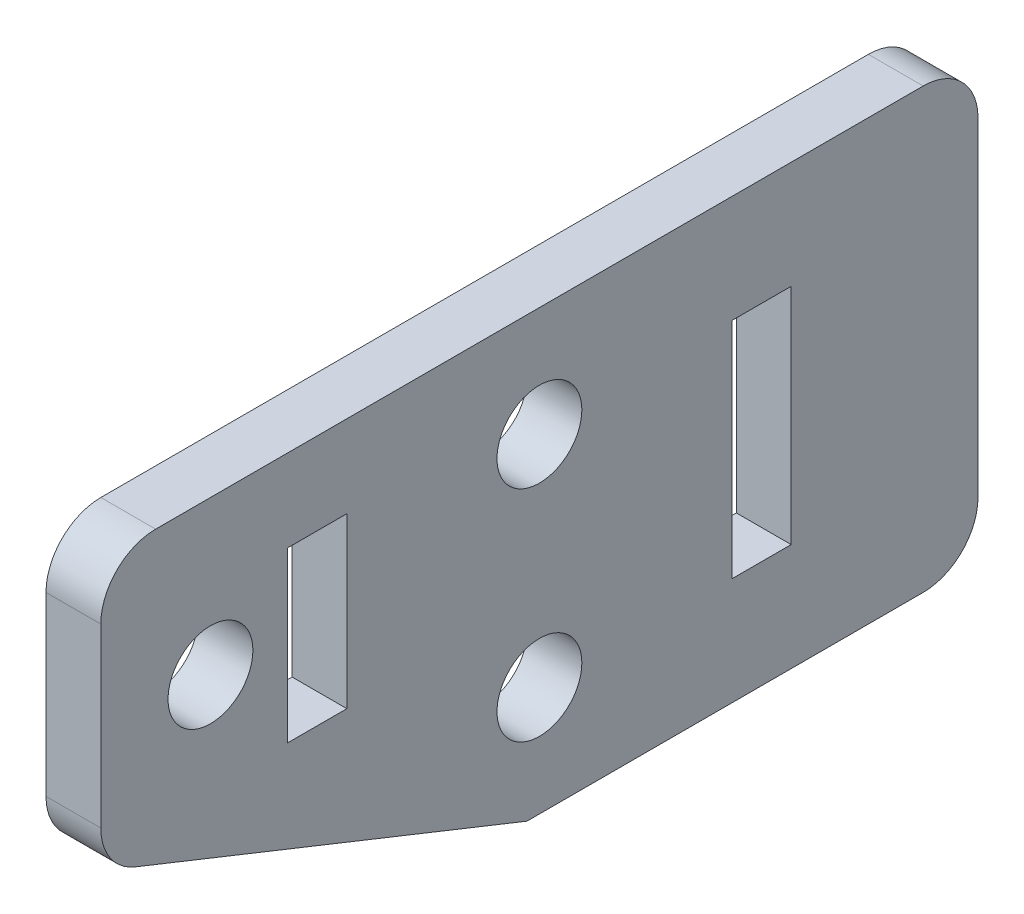
from build123d import *

# Parameters (mm, degrees)
SKETCH2_W                    = 50.8
SKETCH2_H                    = 25.4
BOSS_EXTRUDE1_DEPTH          = 3.175
CUT_EXTRUDE2_DEPTH           = 29.575
FILLET2_R                    = 3.175
SKETCH5_W                    = 3.429
SKETCH5_H                    = 9.779
SKETCH5_H_2                  = 12.954
CUT_EXTRUDE3_DEPTH           = 29.575
F_10_0_1935_DIAMETER_HOLE1_D = 4.9149


with BuildPart() as part:
    # Sketch2 → Boss-Extrude1 (new body)
    with BuildSketch(Plane(origin=(0, 0, 0), x_dir=(0, 0, -1), z_dir=(1, 0, 0))):
        Rectangle(SKETCH2_W, SKETCH2_H)
    extrude(amount=BOSS_EXTRUDE1_DEPTH)

    # Sketch4 → Cut-Extrude2 (cut, through all)
    with BuildSketch(Plane(origin=(3.175, 0, 0), x_dir=(0, 0, -1), z_dir=(1, 0, 0))):
        Polygon((0, -12.98702), (-25.4, -12.7), (-46.852380557, -12.7), (-46.852380557, 5.701326041), (-22.403810306, -4.050651033), align=None)
    extrude(amount=-CUT_EXTRUDE2_DEPTH, mode=Mode.SUBTRACT)

    # Fillet2
    fillet2_edges = [part.edges().sort_by_distance(p)[0] for p in [
        (1.5875, -2.855539298, 25.4),
        (1.5875, 12.7, 25.4),
        (1.5875, 12.7, -25.4),
        (1.5875, -12.7, -25.4),
    ]]
    fillet(fillet2_edges, radius=FILLET2_R)

    # Sketch5 → Cut-Extrude3 (cut, through all)
    with BuildSketch(Plane(origin=(3.175, 0, 0), x_dir=(0, 0, -1), z_dir=(1, 0, 0))):
        with Locations((-12.8651, 3.048)):
            Rectangle(SKETCH5_W, SKETCH5_H)
        with Locations((12.8651, 0)):
            Rectangle(SKETCH5_W, SKETCH5_H_2)
    extrude(amount=-CUT_EXTRUDE3_DEPTH, mode=Mode.SUBTRACT)

    # #10 (0.1935) Diameter Hole1 (through all)
    with Locations(Plane(origin=(3.175, 0, 0), x_dir=(0, 0, -1), z_dir=(1, 0, 0))):
        with Locations((-19.05, 3.81), (0, -6.35), (0, 6.35)):
            Hole(F_10_0_1935_DIAMETER_HOLE1_D / 2)


solid = part.part
